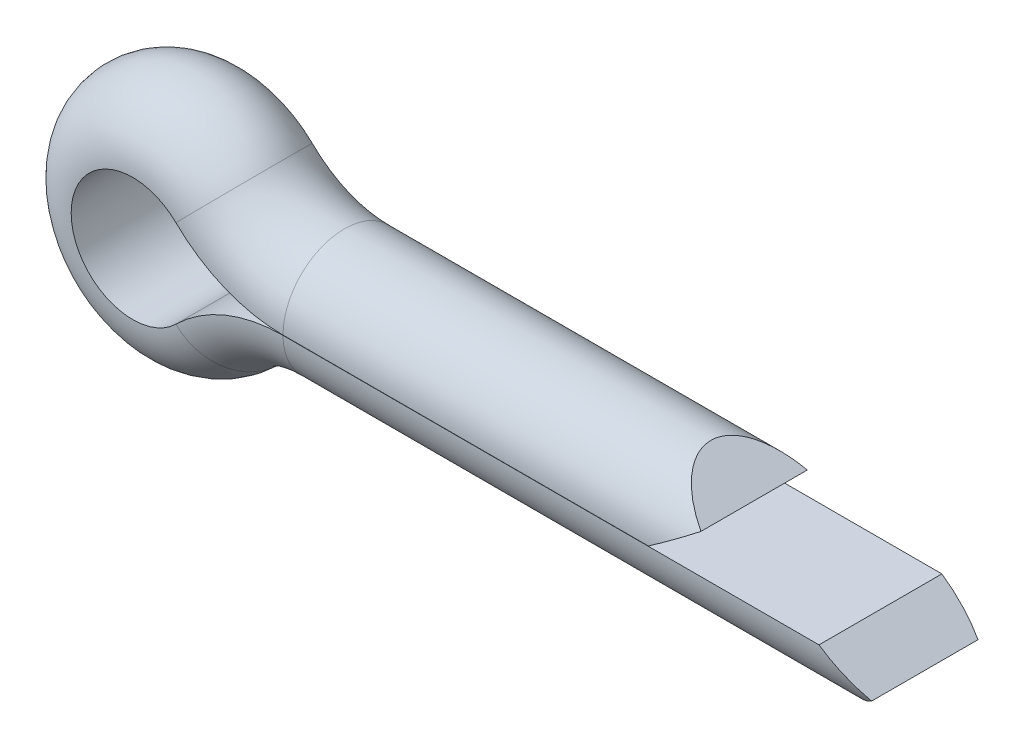
from build123d import *

# Parameters (mm, degrees)
CONECUT_DEPTH      = 9.734986923
CONECUT_DEPTH_BACK = 9.734986923


with BuildPart() as part:
    # Body: sweep along a path in PathSke
    with BuildLine(Plane.XY) as body_path:
        Line((6, 0.9), (0, 0.9))
        ThreePointArc((0, 0.9), (-0.50694731, 0.999684353), (-0.93840708, 1.283893805))
        ThreePointArc((-0.93840708, 1.283893805), (-4, 0), (-0.93840708, -1.283893805))
        ThreePointArc((-0.93840708, -1.283893805), (-0.50694731, -0.999684353), (0, -0.9))
        Line((0, -0.9), (8.5, -0.9))
    # SectionSke → Body (sweep)
    with BuildSketch(Plane(origin=(6, 0, 0), x_dir=(0, 0, -1), z_dir=(1, 0, 0))):
        with BuildLine():
            Line((-0.899997778, 0.002), (0.899997778, 0.002))
            ThreePointArc((0.899997778, 0.002), (0, 0.9), (-0.899997778, 0.002))
        make_face()
    sweep(path=body_path.line)

    # ConeCutSke → ConeCut (cut, two sides: drawn at the far end of the back side and taken through both)
    with BuildSketch(Plane.XY.offset(-CONECUT_DEPTH_BACK)):
        Polygon((6, 0.451), (5.352993487, 0.91), (8.51, 0.91), (8.51, -0.91), (7.852993487, -0.91), (8.5, -0.451), (7.847391827, 0), (5.347391827, 0), align=None)
    extrude(amount=CONECUT_DEPTH + CONECUT_DEPTH_BACK, mode=Mode.SUBTRACT)


solid = part.part
